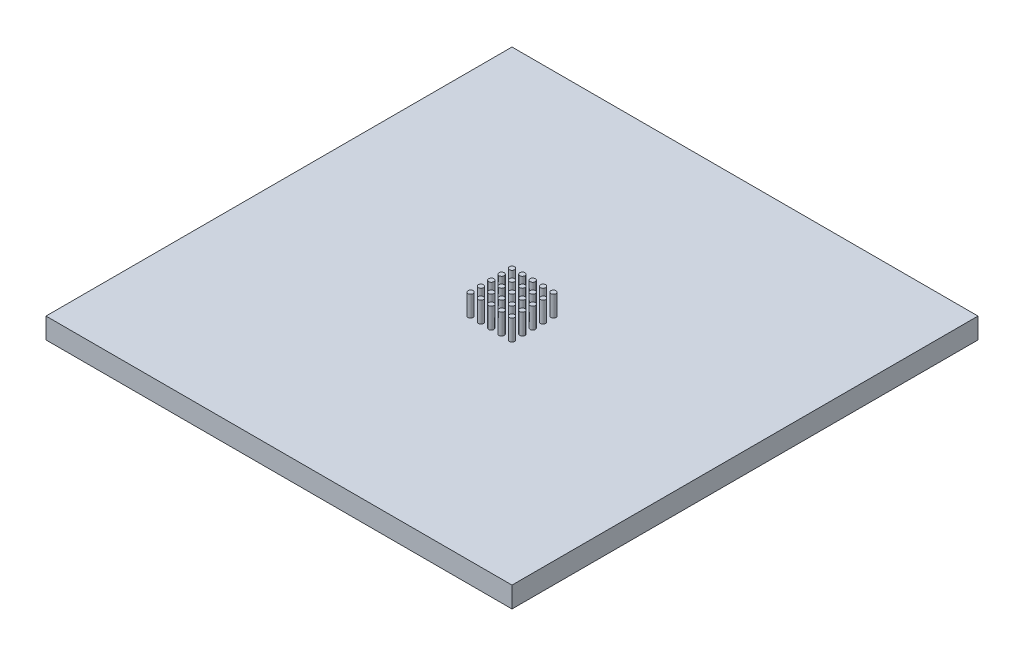
from build123d import *

# Parameters (mm, degrees)
SKETCH1_W                 = 45
SKETCH1_H                 = 45
BASEPLATE_DEPTH           = 2
SKETCH2_R                 = 0.25
PINFIN_DEPTH              = 2
PINFIN_PATTERN_COUNT      = 5
PINFIN_PATTERN_PITCH      = 1
PINFIN_PATTERN_COUNT_DIR2 = 5
PINFIN_PATTERN_PITCH_DIR2 = 1


with BuildPart() as part:
    # Sketch1 → Baseplate (new body)
    with BuildSketch(Plane(origin=(0, 0, 0), x_dir=(1, 0, 0), z_dir=(0, 1, 0))):
        Rectangle(SKETCH1_W, SKETCH1_H)
    extrude(amount=BASEPLATE_DEPTH)

    # Sketch2 → Pinfin (add)
    with BuildSketch(Plane(origin=(0, 2, 0), x_dir=(1, 0, 0), z_dir=(0, 1, 0))):
        with Locations(Location((-2, -2, 0), (0, 0, 270))):
            Circle(SKETCH2_R)
    pinfin = extrude(amount=PINFIN_DEPTH)

    # Pinfin Pattern: Pinfin 5 × 5
    with Locations(*[(j * PINFIN_PATTERN_PITCH_DIR2, 0, -i * PINFIN_PATTERN_PITCH) for i in range(PINFIN_PATTERN_COUNT) for j in range(PINFIN_PATTERN_COUNT_DIR2) if (i, j) != (0, 0)]):
        add(pinfin)


solid = part.part
